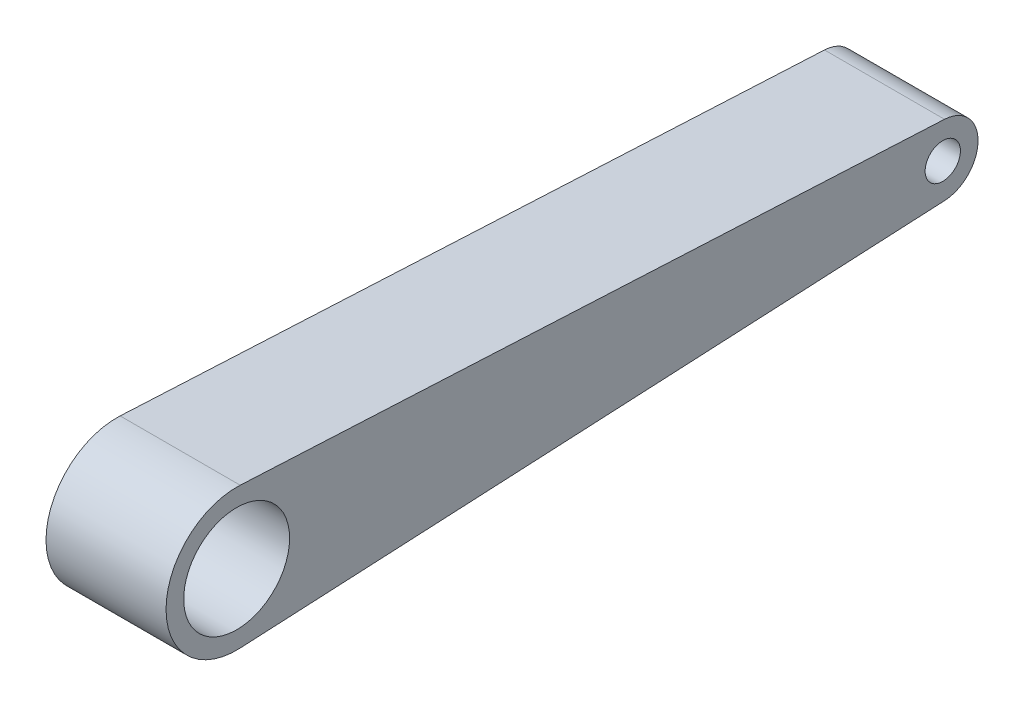
from build123d import *

# Parameters (mm, degrees)
PROFILE_EXTRUDE_DEPTH = 34
HOLES_SKETCH_R        = 5
HOLES_SKETCH_R_2      = 15
HOLES_CUT_DEPTH       = 34


with BuildPart() as part:
    # Profile Sketch → Profile Extrude (new body)
    with BuildSketch(Plane(origin=(0, 0, 0), x_dir=(0, 0, -1), z_dir=(1, 0, 0))):
        with BuildLine():
            Line((-199, 19.974984355), (0.5, 9.987492178))
            ThreePointArc((0.5, 9.987492178), (10, 0), (0.5, -9.987492178))
            Line((0.5, -9.987492178), (-199, -19.974984355))
            ThreePointArc((-199, -19.974984355), (-220, 0), (-199, 19.974984355))
        make_face()
    extrude(amount=PROFILE_EXTRUDE_DEPTH)

    # Holes Sketch → Holes Cut (cut)
    with BuildSketch(Plane(origin=(34, 0, 0), x_dir=(0, 0, -1), z_dir=(1, 0, 0))):
        Circle(HOLES_SKETCH_R)
        with Locations((-200, 0)):
            Circle(HOLES_SKETCH_R_2)
    extrude(amount=-HOLES_CUT_DEPTH, mode=Mode.SUBTRACT)


solid = part.part
